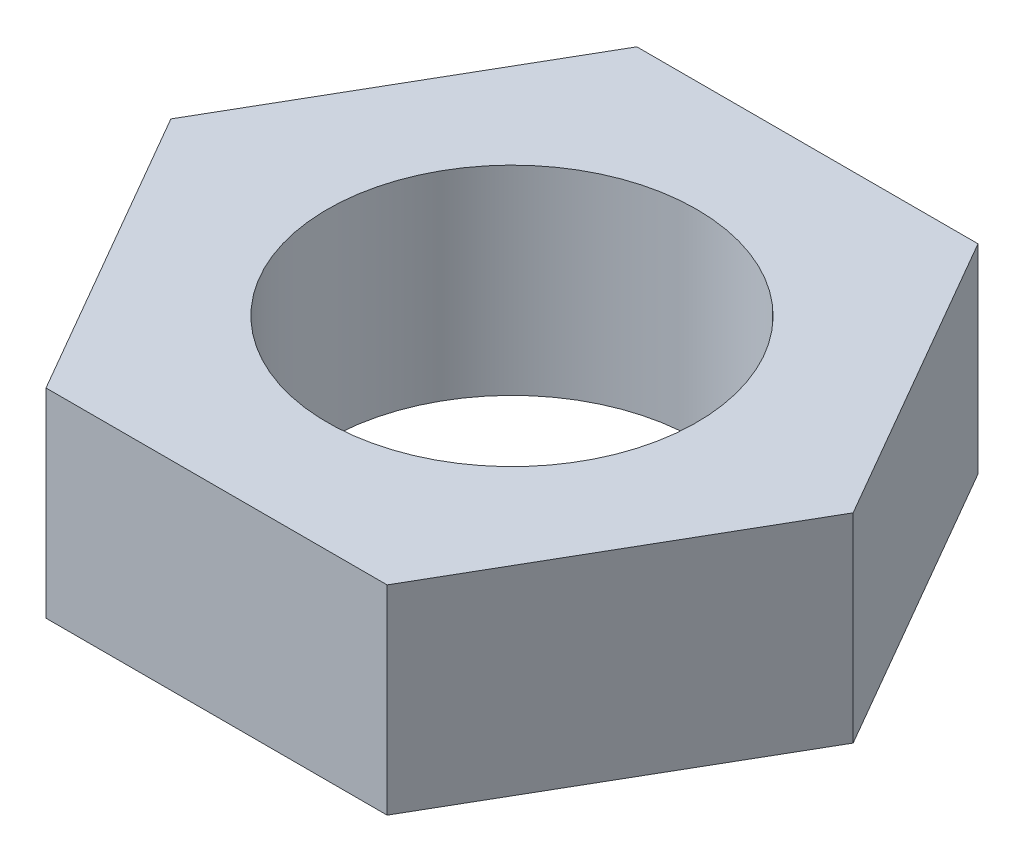
from build123d import *

# Parameters (mm, degrees)
SKETCH2_R           = 2.5
BOSS_EXTRUDE1_DEPTH = 1.35


with BuildPart() as part:
    # Sketch2 → Boss-Extrude1 (new, symmetric)
    with BuildSketch(Plane(origin=(0, 0, 0), x_dir=(1, 0, 0), z_dir=(0, 1, 0))):
        Polygon((2.309401077, 4), (-2.309401077, 4), (-4.618802154, 0), (-2.309401077, -4), (2.309401077, -4), (4.618802154, 0), align=None)
        with Locations(Location((0, 0, 0), (0, 0, 90))):
            Circle(SKETCH2_R, mode=Mode.SUBTRACT)
    extrude(amount=BOSS_EXTRUDE1_DEPTH, both=True)


solid = part.part
